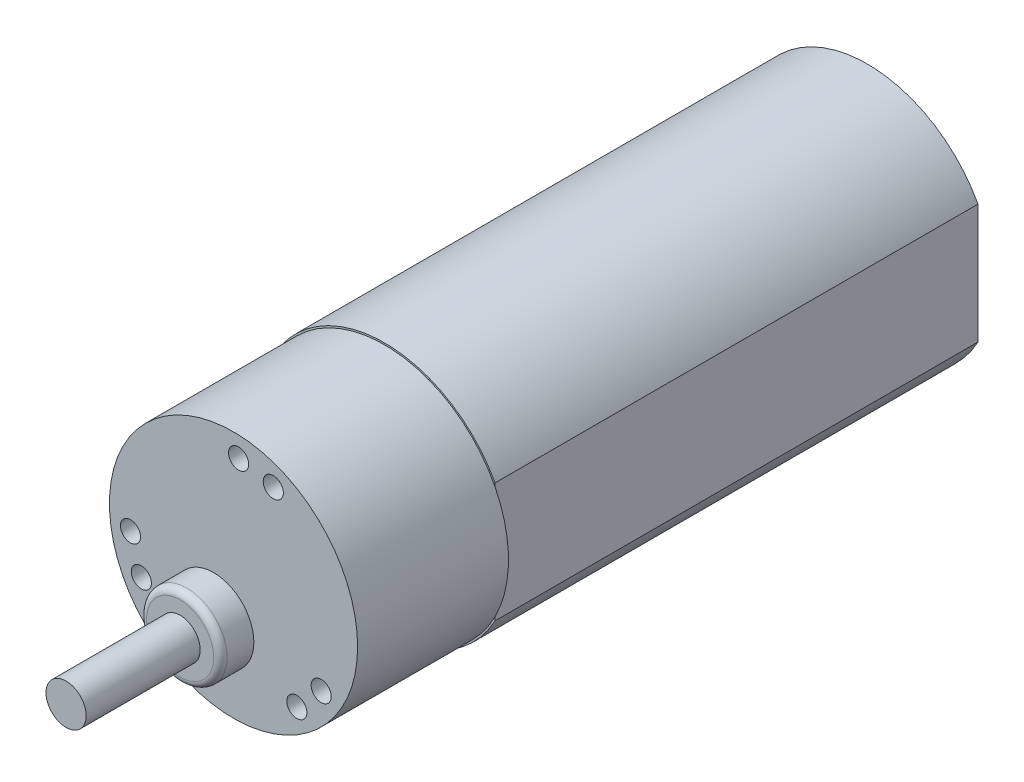
from build123d import *

# Parameters (mm, degrees)
BOSS_EXTRUDE1_DEPTH = 72
SKETCH2_R           = 18.5
BOSS_EXTRUDE2_DEPTH = 22.5
SKETCH3_R           = 1.5
SKETCH3_R_2         = 6
CUT_EXTRUDE1_DEPTH  = 5
BOSS_EXTRUDE3_START = 10
SKETCH4_R           = 6
BOSS_EXTRUDE3_DEPTH = 10
FILLET1_R           = 1
SKETCH5_R           = 3
BOSS_EXTRUDE4_DEPTH = 17
SKETCH6_W           = 14.545544233
SKETCH6_H           = 17.81151313
CUT_EXTRUDE2_DEPTH  = 7


with BuildPart() as part:
    # Sketch1 → Boss-Extrude1 (new body)
    with BuildSketch(Plane.XY):
        with BuildLine():
            Line((-16.5, 8.905756565), (-16.5, -8.905756565))
            ThreePointArc((-16.5, -8.905756565), (0, -18.75), (16.5, -8.905756565))
            Line((16.5, -8.905756565), (16.5, 8.905756565))
            ThreePointArc((16.5, 8.905756565), (0, 18.75), (-16.5, 8.905756565))
        make_face()
    extrude(amount=BOSS_EXTRUDE1_DEPTH)

    # Sketch2 → Boss-Extrude2 (add)
    with BuildSketch(Plane.XY.offset(72)):
        with Locations(Location((0, 0, 0), (0, 0, 153.111952382))):
            Circle(SKETCH2_R)
    extrude(amount=BOSS_EXTRUDE2_DEPTH)

    # Sketch3 → Cut-Extrude1 (cut)
    with BuildSketch(Plane.XY.offset(94.5)):
        with Locations((-13.74680181, -7.160687119)):
            Circle(SKETCH3_R)
        with Locations((0.757881483, 15.430553719)):
            Circle(SKETCH3_R)
        with Locations((13.070128305, -8.426490905)):
            Circle(SKETCH3_R)
        with Locations((-15.366867454, -2.02716172)):
            Circle(SKETCH3_R)
        with Locations((5.92786018, 14.321678452)):
            Circle(SKETCH3_R)
        with Locations((9.439007274, -12.294516732)):
            Circle(SKETCH3_R)
        with Locations((-2.96393009, -7.160839226)):
            Circle(SKETCH3_R_2)
    extrude(amount=-CUT_EXTRUDE1_DEPTH, mode=Mode.SUBTRACT)

    # Sketch4 → Boss-Extrude3 (add)
    with BuildSketch(Plane.XY.offset(89.5).offset(BOSS_EXTRUDE3_START)):
        with Locations((-2.96393009, -7.160839226)):
            Circle(SKETCH4_R)
    extrude(amount=-BOSS_EXTRUDE3_DEPTH)

    # Fillet1
    fillet1_edges = [part.edges().sort_by_distance(p)[0] for p in [
        (-8.96393009, -7.160839226, 99.5),
    ]]
    fillet(fillet1_edges, radius=FILLET1_R)

    # Sketch5 → Boss-Extrude4 (add)
    with BuildSketch(Plane.XY.offset(99.5)):
        with Locations((-2.96393009, -7.160839226)):
            Circle(SKETCH5_R)
    extrude(amount=BOSS_EXTRUDE4_DEPTH)

    # Sketch6 → Cut-Extrude2 (cut)
    with BuildSketch(Plane.ZY.offset(16.5)):
        with Locations((7.272772117, 0)):
            Rectangle(SKETCH6_W, SKETCH6_H)
    extrude(amount=-CUT_EXTRUDE2_DEPTH, mode=Mode.SUBTRACT)


solid = part.part
